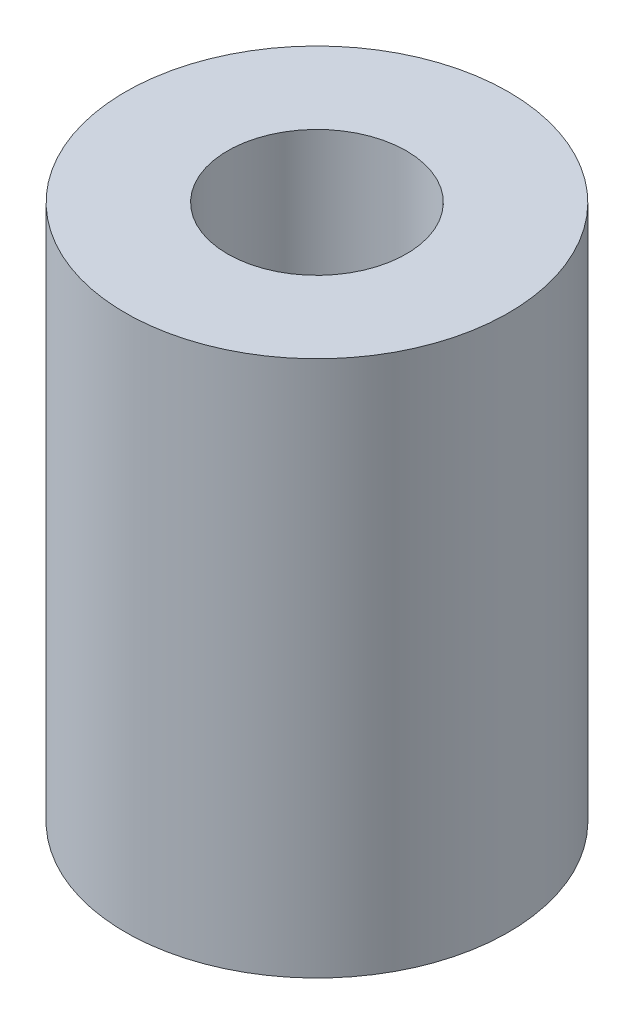
from build123d import *

# Parameters (mm, degrees)
SKETCH1_R                  = 3.75
BOSS_EXTRUDE1_DEPTH        = 10.5
F_3_5_3_5_DIAMETER_HOLE1_D = 3.5


with BuildPart() as part:
    # Sketch1 → Boss-Extrude1 (new body)
    with BuildSketch(Plane(origin=(0, 0, 0), x_dir=(1, 0, 0), z_dir=(0, 1, 0))):
        with Locations(Location((0, 0, 0), (0, 0, 90))):
            Circle(SKETCH1_R)
    extrude(amount=BOSS_EXTRUDE1_DEPTH)

    # Ø3.5 (3.5) Diameter Hole1 (through all)
    with Locations(Plane(origin=(0, 10.5, 0), x_dir=(1, 0, 0), z_dir=(0, 1, 0))):
        with Locations((0, 0)):
            Hole(F_3_5_3_5_DIAMETER_HOLE1_D / 2)


solid = part.part
